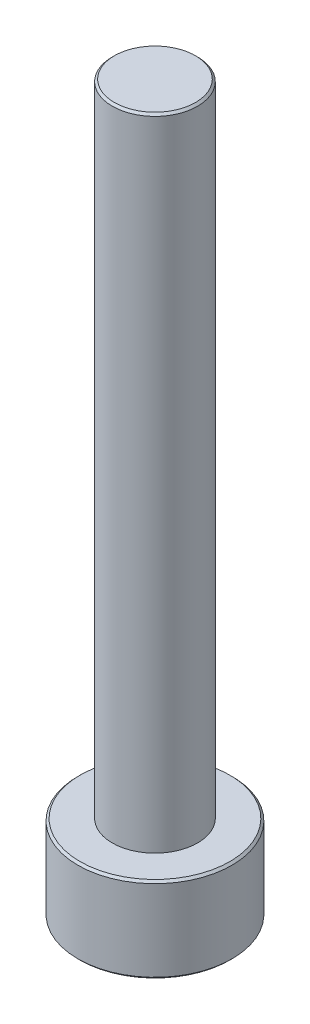
from build123d import *

# Parameters (mm, degrees)
SKETCH_1_R            = 3.61
EXTRUDE_261_DEPTH     = 4
SKETCH_2_R            = 2
EXTRUDE_345_DEPTH     = 30
CUT_EXTRUDE_530_DEPTH = 2
CHAMFER_592_SIZE      = 0.1


with BuildPart() as part:
    # 草图1 → Extrude 261 (new body)
    with BuildSketch(Plane(origin=(0, 0, 0), x_dir=(1, 0, 0), z_dir=(0, 1, 0))):
        with Locations(Location((0, 0, 0), (0, 0, 270))):
            Circle(SKETCH_1_R)
    extrude(amount=EXTRUDE_261_DEPTH)

    # 草图2 → Extrude 345 (add)
    with BuildSketch(Plane(origin=(0, 4, 0), x_dir=(1, 0, 0), z_dir=(0, 1, 0))):
        with Locations(Location((0, 0, 0), (0, 0, 270))):
            Circle(SKETCH_2_R)
    extrude(amount=EXTRUDE_345_DEPTH)

    # 草图3 → Cut-Extrude 530 (cut)
    with BuildSketch(Plane.XZ):
        Polygon((1.54, -0.889119415), (1.54, 0.889119415), (0, 1.778238829), (-1.54, 0.889119415), (-1.54, -0.889119415), (0, -1.778238829), align=None)
    extrude(amount=-CUT_EXTRUDE_530_DEPTH, mode=Mode.SUBTRACT)

    # Chamfer 592
    chamfer_592_edges = [part.edges().sort_by_distance(p)[0] for p in [
        (0, 0, -3.61),
        (0, 4, -3.61),
        (0, 34, -2),
    ]]
    chamfer(chamfer_592_edges, length=CHAMFER_592_SIZE)


solid = part.part
